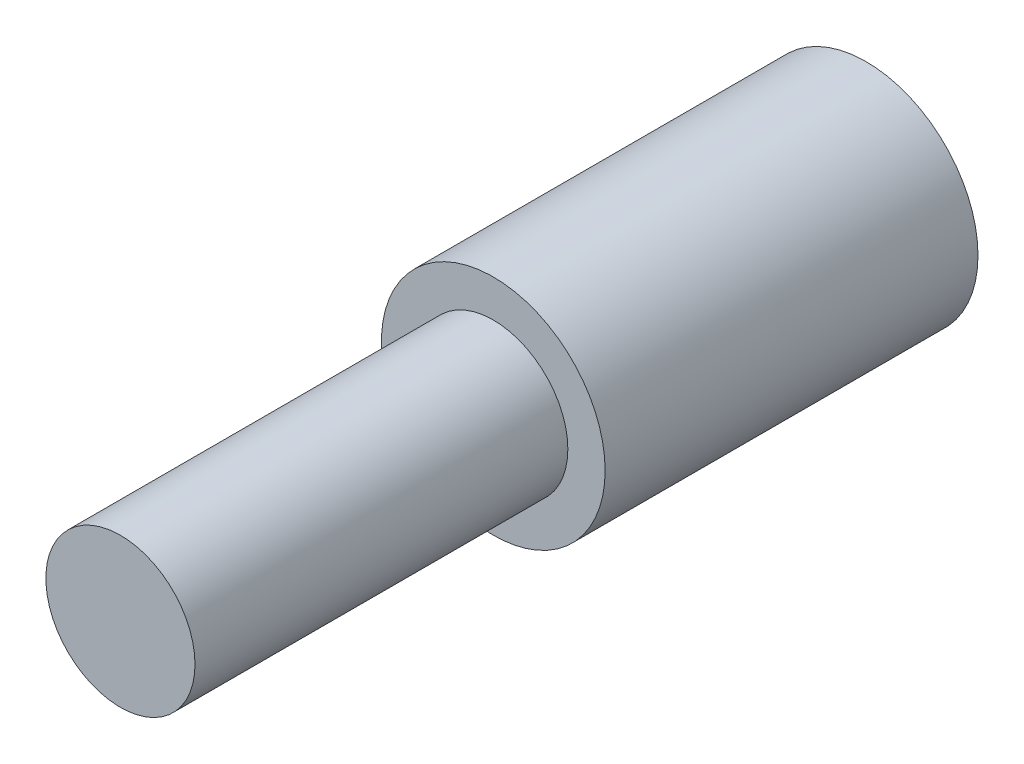
from build123d import *

# Parameters (mm, degrees)
SKETCH1_R           = 3
BOSS_EXTRUDE1_DEPTH = 10
SKETCH2_R           = 2
BOSS_EXTRUDE2_DEPTH = 10


with BuildPart() as part:
    # Sketch1 → Boss-Extrude1 (new body)
    with BuildSketch(Plane.XY):
        Circle(SKETCH1_R)
    extrude(amount=BOSS_EXTRUDE1_DEPTH)

    # Sketch2 → Boss-Extrude2 (add)
    with BuildSketch(Plane.XY.offset(10)):
        Circle(SKETCH2_R)
    extrude(amount=BOSS_EXTRUDE2_DEPTH)


solid = part.part
